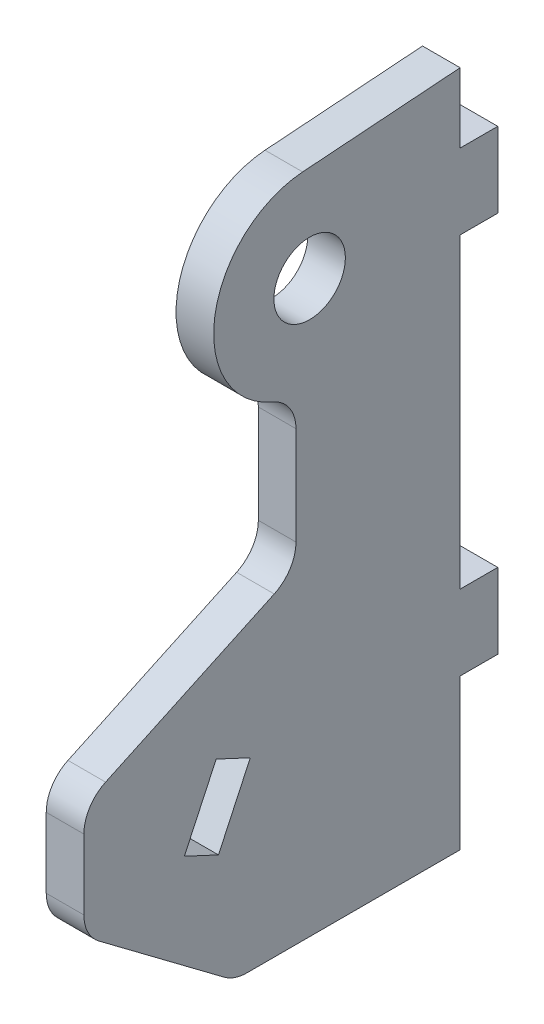
from build123d import *

# Parameters (mm, degrees)
SKETCH1_R           = 4.75
BOSS_EXTRUDE1_DEPTH = 2.5
FILLET1_R           = 5
CUT_EXTRUDE1_REACH  = 92.908
SKETCH3_W           = 5
SKETCH3_H           = 10
BOSS_EXTRUDE2_DEPTH = 5


with BuildPart() as part:
    # Sketch1 → Boss-Extrude1 (new, symmetric)
    with BuildSketch(Plane.YZ):
        with BuildLine():
            Line((-15.757717512, 0), (-5, 0))
            Line((-5, 0), (-5, -5))
            Line((-5, -5), (5, -5))
            Line((5, -5), (5, 0))
            Line((5, 0), (14.242282488, 0))
            Line((14.242282488, 0), (12.716235334, 20.927285791))
            ThreePointArc((12.716235334, 20.927285791), (0.446501859, 32.742179409), (-12.620138577, 21.815103933))
            Line((-12.620138577, 21.815103933), (-32.620138577, 21.815103933))
            Line((-32.620138577, 21.815103933), (-45.757717512, 50))
            Line((-45.757717512, 50), (-60.757717512, 50))
            Line((-60.757717512, 50), (-75.757717512, 30))
            Line((-75.757717512, 30), (-75.757717512, 0))
            Line((-75.757717512, 0), (-15.757717512, 0))
        make_face()
        with Locations(Location((0, 20, 0), (0, 0, 270))):
            Circle(SKETCH1_R, mode=Mode.SUBTRACT)
    extrude(amount=BOSS_EXTRUDE1_DEPTH, both=True)

    # Fillet1
    fillet1_edges = [part.edges().sort_by_distance(p)[0] for p in [
        (0, -75.757717512, 30),
        (0, -60.757717512, 50),
        (0, -45.757717512, 50),
        (0, -32.620138577, 21.815103933),
        (0, -12.620138577, 21.815103933),
    ]]
    fillet(fillet1_edges, radius=FILLET1_R)

    # Sketch2 → Cut-Extrude1 (cut, up to next)
    with BuildSketch(Plane.YZ.offset(2.5), mode=Mode.PRIVATE) as cut_extrude1_sk1:
        Polygon((-51.226178577, 27.886908691), (-60.289256447, 32.113091309), (-58.176165138, 36.644630244), (-49.113087268, 32.418447626), align=None)
    cut_extrude1_tool1 = extrude(cut_extrude1_sk1.sketch, amount=-CUT_EXTRUDE1_REACH, mode=Mode.PRIVATE) & part.part
    add(cut_extrude1_tool1.solids().sort_by_distance((2.5, -54.701172, 32.265769))[0], mode=Mode.SUBTRACT)

    # Sketch3 → Boss-Extrude2 (add)
    with BuildSketch(Plane(origin=(0, 0, 0), x_dir=(1, 0, 0), z_dir=(0, 0, -1))):
        with Locations((0, 50.757717512)):
            Rectangle(SKETCH3_W, SKETCH3_H)
    extrude(amount=BOSS_EXTRUDE2_DEPTH)


solid = part.part
